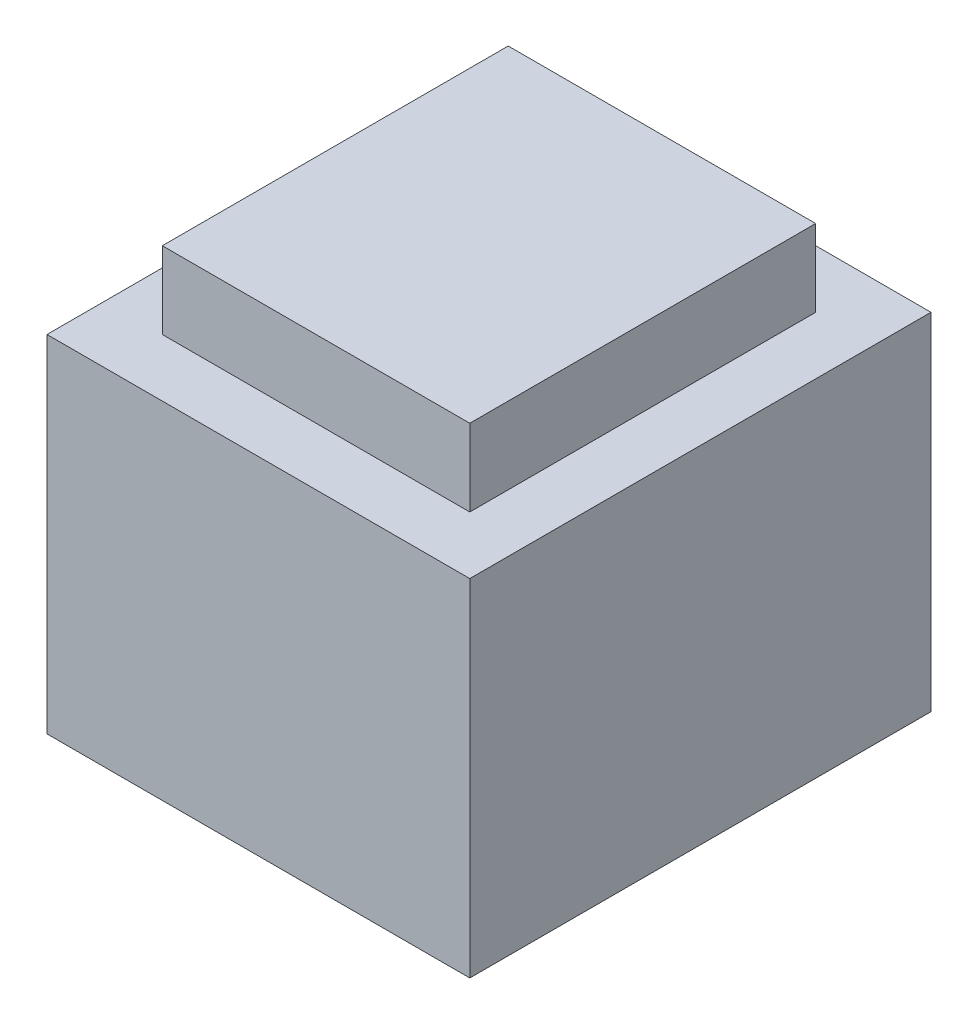
from build123d import *

# Parameters (mm, degrees)
SKETCH_1_W      = 11
SKETCH_1_H      = 12
EXTRUDE_1_DEPTH = 9
SKETCH_2_W      = 8
SKETCH_2_H      = 9
EXTRUDE_2_DEPTH = 2


with BuildPart() as part:
    # Эскиз1 → Бобышка-Вытянуть1 (new body)
    with BuildSketch(Plane(origin=(0, 0, 0), x_dir=(1, 0, 0), z_dir=(0, 1, 0))):
        Rectangle(SKETCH_1_W, SKETCH_1_H)
    extrude(amount=EXTRUDE_1_DEPTH)

    # Эскиз2 → Бобышка-Вытянуть2 (add)
    with BuildSketch(Plane(origin=(0, 9, 0), x_dir=(1, 0, 0), z_dir=(0, 1, 0))):
        Rectangle(SKETCH_2_W, SKETCH_2_H)
    extrude(amount=EXTRUDE_2_DEPTH)


solid = part.part
